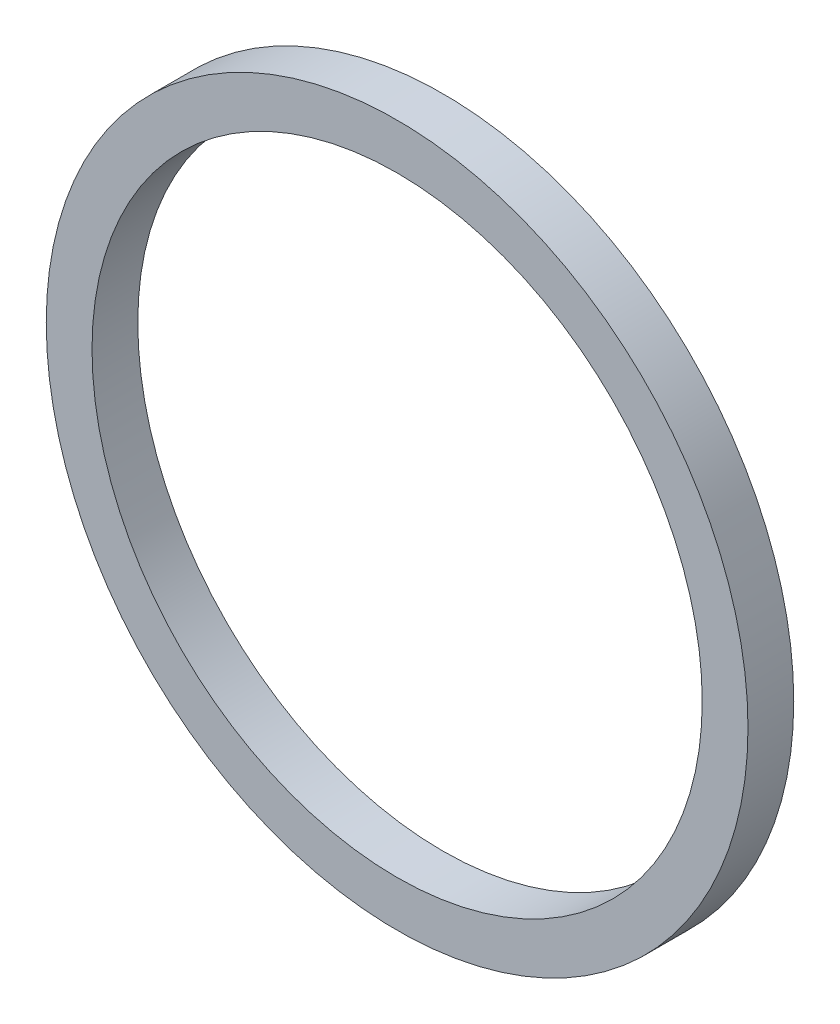
from build123d import *

# Parameters (mm, degrees)
SKETCH_1_R      = 11.5
SKETCH_1_R_2    = 10
EXTRUDE_1_DEPTH = 1.5


with BuildPart() as part:
    # 草图1 → 凸台-拉伸1 (new body)
    with BuildSketch(Plane.XY):
        Circle(SKETCH_1_R)
        Circle(SKETCH_1_R_2, mode=Mode.SUBTRACT)
    extrude(amount=EXTRUDE_1_DEPTH)


solid = part.part
